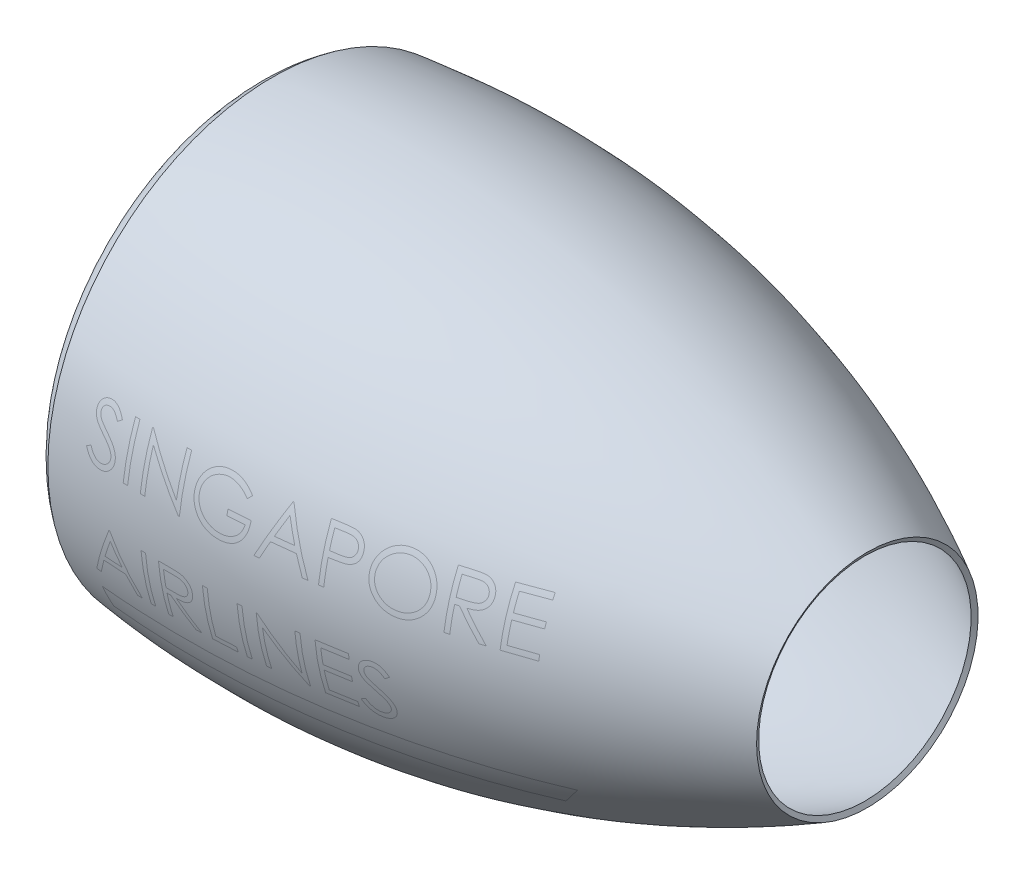
from build123d import *

# Parameters (mm, degrees)
THICKEN1_T1 = 5


with BuildPart() as body_1:
    # Surface-Revolve1: a surface, the sketch's curves turned about an axis
    with BuildLine(Plane.XY, mode=Mode.PRIVATE) as surface_revolve1_1_path:
        Line((59.734574576, 190), (34.734574576, 190))
        Line((34.734574576, 190), (25, 180))
        Line((25, 180), (0, 180))
        add(Edge.make_bspline(
            [(0, 180), (-34.270276872, 195.629675538), (0, 219.16297851)],
            knots=[0, 0, 0, 1, 1, 1], degree=2))
        add(Edge.make_bspline(
            [(0, 219.16297851), (306.474811975, 257.077004925), (580, 108)],
            knots=[0, 0, 0, 1, 1, 1], degree=2))
    surface_revolve1_1 = Shell.revolve(surface_revolve1_1_path.wire(), 360, Axis((666.178471284, 0, 0), (-1, 0, 0)))
    add(Solid.thicken(surface_revolve1_1, THICKEN1_T1))


solid = body_1.part
